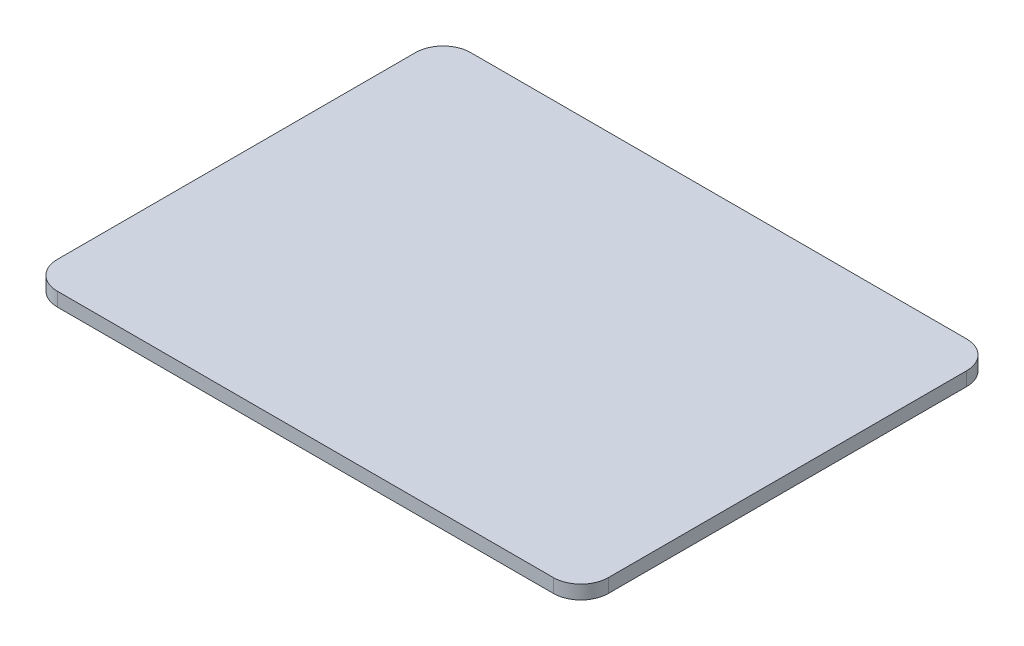
from build123d import *

# Parameters (mm, degrees)
SKETCH1_W           = 8000
SKETCH1_H           = 6000
BOSS_EXTRUDE1_DEPTH = 200
FILLET1_R           = 400


with BuildPart() as part:
    # Sketch1 → Boss-Extrude1 (new body)
    with BuildSketch(Plane(origin=(0, 0, 0), x_dir=(1, 0, 0), z_dir=(0, 1, 0))):
        Rectangle(SKETCH1_W, SKETCH1_H)
    extrude(amount=BOSS_EXTRUDE1_DEPTH)

    # Fillet1
    fillet1_edges = [part.edges().sort_by_distance(p)[0] for p in [
        (4000, 100, 3000),
        (-4000, 100, 3000),
        (-4000, 100, -3000),
        (4000, 100, -3000),
    ]]
    fillet(fillet1_edges, radius=FILLET1_R)


solid = part.part
